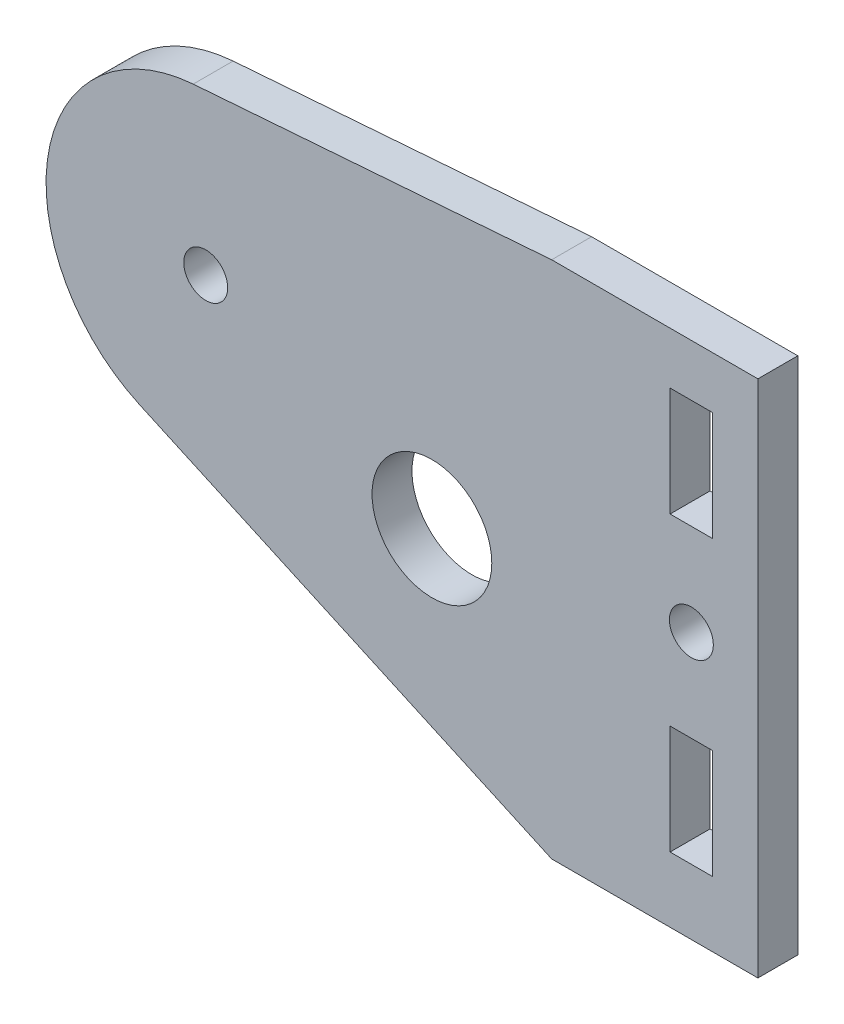
from build123d import *

# Parameters (mm, degrees)
ESKIZ_KONTUR_W        = 3.2
ESKIZ_KONTUR_H        = 8.2
PLASTINA_DEPTH        = 3
OTVERSTIYA_DEPTH      = 49.541218109
OTVERSTIYA_DEPTH_BACK = 49.541218109
ESKIZ_OTVERSTIYA_R    = 4.5
ESKIZ_OTVERSTIYA_R_2  = 1.65


with BuildPart() as part:
    # Eskiz_kontur → Plastina (new body)
    with BuildSketch(Plane.XY):
        with BuildLine():
            Line((41.499998426, -24.999999723), (25.999998426, -24.999999723))
            Line((25.999998426, -24.999999723), (-4.976321574, -10.919529723))
            ThreePointArc((-4.976321574, -10.919529723), (-11.817691954, 2.083782335), (-0.94151, 11.96301))
            Line((-0.94151, 11.96301), (26, 14))
            Line((26, 14), (41.499998426, 14))
            Line((41.499998426, 14), (41.499998426, -24.999999723))
        make_face()
        with Locations((36.5, -16)):
            Rectangle(ESKIZ_KONTUR_W, ESKIZ_KONTUR_H, mode=Mode.SUBTRACT)
        with Locations((36.5, 6)):
            Rectangle(ESKIZ_KONTUR_W, ESKIZ_KONTUR_H, mode=Mode.SUBTRACT)
    extrude(amount=PLASTINA_DEPTH)

    # Eskiz_otverstiya → Otverstiya (cut, two sides: drawn at the far end of the back side and taken through both)
    with BuildSketch(Plane.XY.offset(-OTVERSTIYA_DEPTH_BACK)):
        with Locations((17, -8)):
            Circle(ESKIZ_OTVERSTIYA_R)
        Circle(ESKIZ_OTVERSTIYA_R_2)
        with Locations((36.5, -5)):
            Circle(ESKIZ_OTVERSTIYA_R_2)
    extrude(amount=OTVERSTIYA_DEPTH + OTVERSTIYA_DEPTH_BACK, mode=Mode.SUBTRACT)


solid = part.part
